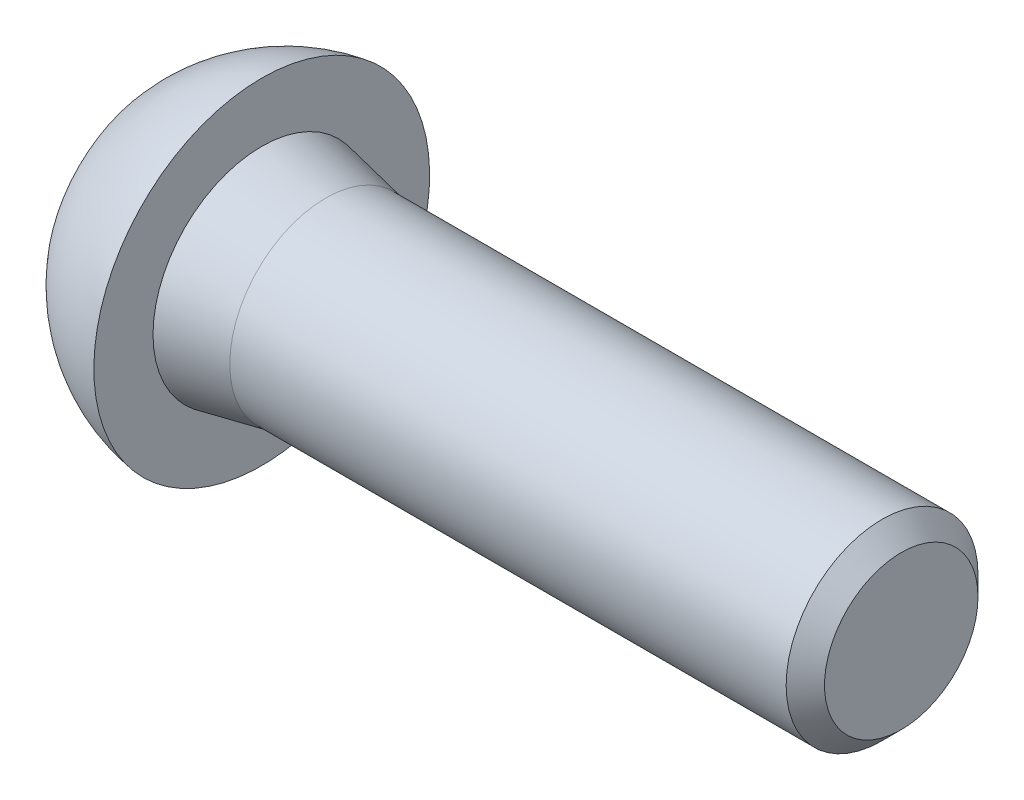
from build123d import *

# Parameters (mm, degrees)
CUT_EXTRUDE_1_DEPTH = 2.08
CHAMFER_1_SIZE      = 0.6


with BuildPart() as part:
    # 草图1 → 旋转1 (revolve)
    with BuildSketch(Plane.XY, mode=Mode.PRIVATE) as revolve_1_sk:
        with BuildLine():
            Line((0, 0), (0, 3))
            Line((0, 3), (-18, 3))
            Line((-18, 3), (-20, 3.4))
            Line((-20, 3.4), (-20, 5.25))
            ThreePointArc((-20, 5.25), (-21.818247324, 4.638396814), (-23.3, 3.42))
            Line((-23.3, 3.42), (-23.3, 0))
            Line((-23.3, 0), (0, 0))
        make_face()
    revolve(revolve_1_sk.sketch.rotate(Axis((0, 0, 0), (-1, 0, 0)), 90), axis=Axis((0, 0, 0), (-1, 0, 0)))

    # 草图4 → 切除-拉伸1 (cut)
    with BuildSketch(Plane.ZY.offset(23.3)):
        Polygon((0, 2.309401077), (-2, 1.154700538), (-2, -1.154700538), (0, -2.309401077), (2, -1.154700538), (2, 1.154700538), align=None)
    extrude(amount=-CUT_EXTRUDE_1_DEPTH, mode=Mode.SUBTRACT)

    # 倒角1
    chamfer_1_edges = [part.edges().sort_by_distance(p)[0] for p in [
        (0, 0, 3),
    ]]
    chamfer(chamfer_1_edges, length=CHAMFER_1_SIZE)

    # 草图6 → 切除-放样1 section 0
    with BuildSketch(Plane.ZY.offset(21.22), mode=Mode.PRIVATE) as loft_1_s0:
        with BuildLine():
            Line((0, 2.309401077), (-2, 1.154700538))
            Line((-2, 1.154700538), (-2, -1.154700538))
            Line((-2, -1.154700538), (0, -2.309401077))
            Line((0, -2.309401077), (2, -1.154700538))
            Line((2, -1.154700538), (2, 1.154700538))
            Line((2, 1.154700538), (0, 2.309401077))
        make_face()
    loft([Vertex(-20.8075, 0, 0), loft_1_s0.sketch], mode=Mode.SUBTRACT)


solid = part.part
